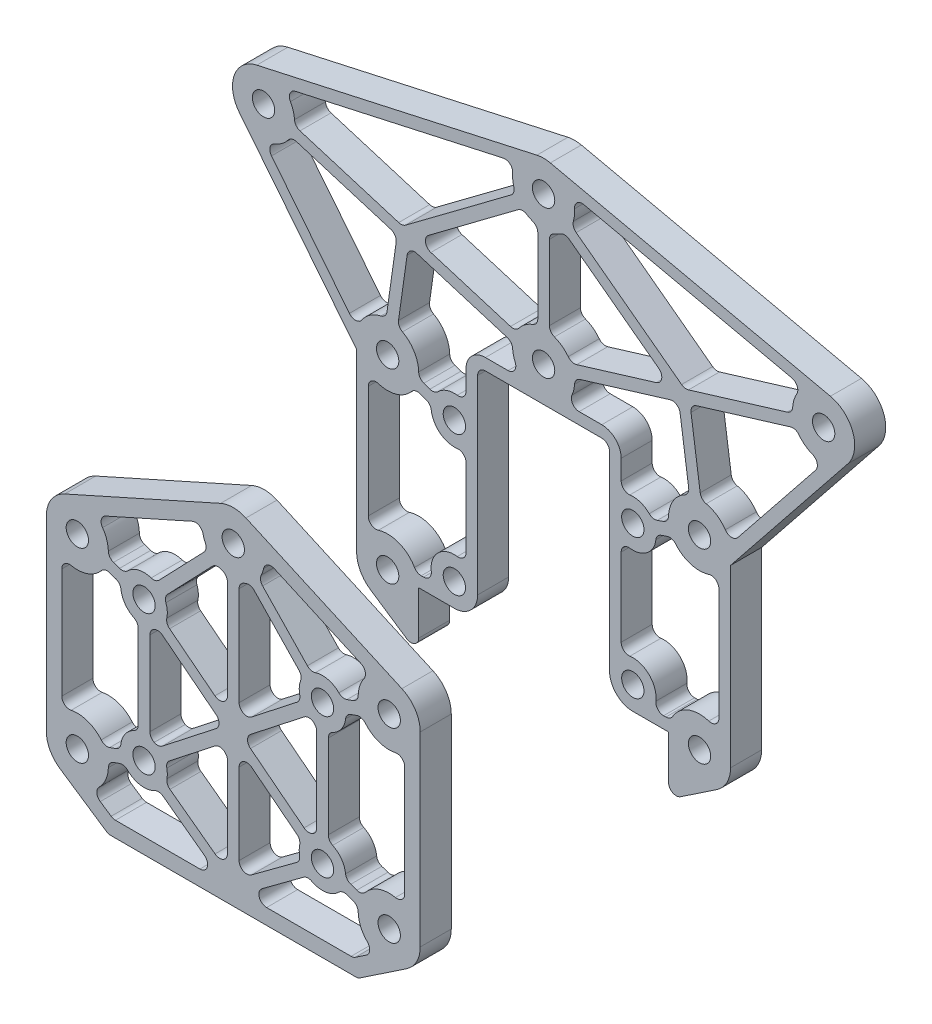
from build123d import *

# Parameters (mm, degrees)
SKETCH1_R               = 2.286
BOSS_EXTRUDE1_DEPTH     = 6.35
BOSS_EXTRUDE2_START     = -57.15
SKETCH1_3_R             = 2.286
BOSS_EXTRUDE2_DEPTH     = 6.35
FILLET1_R               = 1.5875
FILLET2_R               = 1.5875
CUT_EXTRUDE1_DEPTH      = 7.62
FILLET3_R               = 4.7625
CUT_EXTRUDE2_START      = -9.525
SKETCH4_R               = 2.286
CUT_EXTRUDE2_DEPTH      = 9.525
CUT_EXTRUDE3_DEPTH      = 118.518004797
CUT_EXTRUDE3_DEPTH_BACK = 118.518004797
SKETCH4_3_R             = 2.286
CUT_EXTRUDE4_START      = -7.62
CUT_EXTRUDE4_DEPTH      = 7.62
FILLET4_R               = 1.5875
CUT_EXTRUDE5_DEPTH      = 7.62
FILLET5_R               = 1.5875


with BuildPart() as part:
    # Sketch1 → Boss-Extrude1 (new body)
    with BuildSketch(Plane.XY):
        with BuildLine():
            Line((-25.55875, -30.95625), (25.55875, -30.95625))
            Line((25.55875, -30.95625), (35.446293253, -24.323356401))
            ThreePointArc((35.446293253, -24.323356401), (37.511691176, -22.038235294), (38.25875, -19.05))
            Line((38.25875, -19.05), (38.25875, 16.822540273))
            Line((38.25875, 16.822540273), (62.26726694, 46.833186448))
            ThreePointArc((62.26726694, 46.833186448), (63.297385155, 52.911575001), (58.682621452, 56.999594925))
            Line((58.682621452, 56.999594925), (1.373871452, 69.699594925))
            ThreePointArc((1.373871452, 69.699594925), (0, 69.85), (-1.373871452, 69.699594925))
            Line((-1.373871452, 69.699594925), (-58.682621452, 56.999594925))
            ThreePointArc((-58.682621452, 56.999594925), (-63.297385155, 52.911575001), (-62.26726694, 46.833186448))
            Line((-62.26726694, 46.833186448), (-38.25875, 16.822540273))
            Line((-38.25875, 16.822540273), (-38.25875, -19.05))
            ThreePointArc((-38.25875, -19.05), (-37.511691176, -22.038235294), (-35.446293253, -24.323356401))
            Line((-35.446293253, -24.323356401), (-25.55875, -30.95625))
        make_face()
        with Locations((-31.90875, -19.05)):
            Circle(SKETCH1_R, mode=Mode.SUBTRACT)
        with Locations((-18.25625, -14.2875)):
            Circle(SKETCH1_R, mode=Mode.SUBTRACT)
        with Locations((18.25625, -14.2875)):
            Circle(SKETCH1_R, mode=Mode.SUBTRACT)
        with Locations((31.90875, -19.05)):
            Circle(SKETCH1_R, mode=Mode.SUBTRACT)
        with Locations((-31.90875, 19.05)):
            Circle(SKETCH1_R, mode=Mode.SUBTRACT)
        with Locations((-57.30875, 50.8)):
            Circle(SKETCH1_R, mode=Mode.SUBTRACT)
        with Locations((31.90875, 19.05)):
            Circle(SKETCH1_R, mode=Mode.SUBTRACT)
        with Locations((57.30875, 50.8)):
            Circle(SKETCH1_R, mode=Mode.SUBTRACT)
        with Locations((0, 63.5)):
            Circle(SKETCH1_R, mode=Mode.SUBTRACT)
    extrude(amount=BOSS_EXTRUDE1_DEPTH)

    # Fillet2
    fillet2_edges = [part.edges().sort_by_distance(p)[0] for p in [
        (25.55875, -30.95625, 3.175),
        (-25.55875, -30.95625, 3.175),
    ]]
    fillet(fillet2_edges, radius=FILLET2_R)

    # Sketch4 → Cut-Extrude2 (cut)
    # profile 1 of 3: a face of its own
    with BuildSketch(Plane.XY.offset(6.35).offset(CUT_EXTRUDE2_START)):
        with BuildLine():
            Line((-98.245897659, 9.07752692), (-38.25875, 16.822540273))
            Line((-38.25875, 16.822540273), (-62.26726694, 46.833186448))
            ThreePointArc((-62.26726694, 46.833186448), (-63.297385155, 52.911575001), (-58.682621452, 56.999594925))
            Line((-58.682621452, 56.999594925), (-1.373871452, 69.699594925))
            ThreePointArc((-1.373871452, 69.699594925), (0, 69.85), (1.373871452, 69.699594925))
            Line((1.373871452, 69.699594925), (58.682621452, 56.999594925))
            ThreePointArc((58.682621452, 56.999594925), (63.297385155, 52.911575001), (62.26726694, 46.833186448))
            Line((62.26726694, 46.833186448), (38.25875, 16.822540273))
            Line((38.25875, 16.822540273), (125.422392006, 90.402311249))
            Line((125.422392006, 90.402311249), (-79.231707288, 82.909223574))
            Line((-79.231707288, 82.909223574), (-98.245897659, 9.07752692))
        make_face()
    # profile 2 of 3: a face of its own
    with BuildSketch(Plane.XY.offset(6.35).offset(CUT_EXTRUDE2_START)):
        with Locations((0, 33.3375)):
            Circle(SKETCH4_R)
    # profile 3 of 3: a face of its own
    with BuildSketch(Plane.XY.offset(6.35).offset(CUT_EXTRUDE2_START)):
        with BuildLine():
            ThreePointArc((-38.25875, 19.05), (-37.237956498, 22.502833345), (-34.503771069, 24.845547054))
            Line((-34.503771069, 24.845547054), (-2.595021069, 39.133047054))
            ThreePointArc((-2.595021069, 39.133047054), (0, 39.6875), (2.595021069, 39.133047054))
            Line((2.595021069, 39.133047054), (34.503771069, 24.845547054))
            ThreePointArc((34.503771069, 24.845547054), (37.237956498, 22.502833345), (38.25875, 19.05))
            Line((38.25875, 19.05), (38.25875, 16.822540273))
            Line((38.25875, 16.822540273), (62.26726694, 46.833186448))
            ThreePointArc((62.26726694, 46.833186448), (63.297385155, 52.911575001), (58.682621452, 56.999594925))
            Line((58.682621452, 56.999594925), (1.373871452, 69.699594925))
            ThreePointArc((1.373871452, 69.699594925), (0, 69.85), (-1.373871452, 69.699594925))
            Line((-1.373871452, 69.699594925), (-58.682621452, 56.999594925))
            ThreePointArc((-58.682621452, 56.999594925), (-63.297385155, 52.911575001), (-62.26726694, 46.833186448))
            Line((-62.26726694, 46.833186448), (-38.25875, 16.822540273))
            Line((-38.25875, 16.822540273), (-38.25875, 19.05))
        make_face()
        with Locations(Location((-57.30875, 50.8, 0), (0, 0, 270))):
            Circle(SKETCH4_R, mode=Mode.SUBTRACT)
        with Locations(Location((0, 63.5, 0), (0, 0, 270))):
            Circle(SKETCH4_R, mode=Mode.SUBTRACT)
        with Locations(Location((57.30875, 50.8, 0), (0, 0, 270))):
            Circle(SKETCH4_R, mode=Mode.SUBTRACT)
    extrude(amount=CUT_EXTRUDE2_DEPTH, mode=Mode.SUBTRACT)


with BuildPart() as body_2:
    # Sketch1<3> → Boss-Extrude2 (new body)
    with BuildSketch(Plane.XY.offset(BOSS_EXTRUDE2_START)):
        with BuildLine():
            Line((-25.55875, -19.05), (25.55875, -19.05))
            Line((25.55875, -19.05), (25.55875, -30.95625))
            Line((25.55875, -30.95625), (35.446293253, -24.323356401))
            ThreePointArc((35.446293253, -24.323356401), (37.511691176, -22.038235294), (38.25875, -19.05))
            Line((38.25875, -19.05), (38.25875, 16.822540273))
            Line((38.25875, 16.822540273), (62.26726694, 46.833186448))
            ThreePointArc((62.26726694, 46.833186448), (63.297385155, 52.911575001), (58.682621452, 56.999594925))
            Line((58.682621452, 56.999594925), (1.373871452, 69.699594925))
            ThreePointArc((1.373871452, 69.699594925), (0, 69.85), (-1.373871452, 69.699594925))
            Line((-1.373871452, 69.699594925), (-58.682621452, 56.999594925))
            ThreePointArc((-58.682621452, 56.999594925), (-63.297385155, 52.911575001), (-62.26726694, 46.833186448))
            Line((-62.26726694, 46.833186448), (-38.25875, 16.822540273))
            Line((-38.25875, 16.822540273), (-38.25875, -19.05))
            ThreePointArc((-38.25875, -19.05), (-37.511691176, -22.038235294), (-35.446293253, -24.323356401))
            Line((-35.446293253, -24.323356401), (-25.55875, -30.95625))
            Line((-25.55875, -30.95625), (-25.55875, -19.05))
        make_face()
        with Locations(Location((-31.90875, -19.05, 0), (0, 0, 270))):
            Circle(SKETCH1_3_R, mode=Mode.SUBTRACT)
        with Locations(Location((-18.25625, -14.2875, 0), (0, 0, 270))):
            Circle(SKETCH1_3_R, mode=Mode.SUBTRACT)
        with Locations(Location((18.25625, -14.2875, 0), (0, 0, 270))):
            Circle(SKETCH1_3_R, mode=Mode.SUBTRACT)
        with Locations(Location((31.90875, -19.05, 0), (0, 0, 270))):
            Circle(SKETCH1_3_R, mode=Mode.SUBTRACT)
        with Locations(Location((-31.90875, 19.05, 0), (0, 0, 270))):
            Circle(SKETCH1_3_R, mode=Mode.SUBTRACT)
        with Locations(Location((-57.30875, 50.8, 0), (0, 0, 270))):
            Circle(SKETCH1_3_R, mode=Mode.SUBTRACT)
        with Locations(Location((31.90875, 19.05, 0), (0, 0, 270))):
            Circle(SKETCH1_3_R, mode=Mode.SUBTRACT)
        with Locations(Location((57.30875, 50.8, 0), (0, 0, 270))):
            Circle(SKETCH1_3_R, mode=Mode.SUBTRACT)
        with Locations(Location((0, 63.5, 0), (0, 0, 270))):
            Circle(SKETCH1_3_R, mode=Mode.SUBTRACT)
    extrude(amount=-BOSS_EXTRUDE2_DEPTH)

    # Fillet1
    fillet1_edges = [body_2.edges().sort_by_distance(p)[0] for p in [
        (-25.55875, -30.95625, -60.325),
        (25.55875, -30.95625, -60.325),
    ]]
    fillet(fillet1_edges, radius=FILLET1_R)

    # Sketch3 → Cut-Extrude1 (cut)
    with BuildSketch(Plane(origin=(0, 0, -63.5), x_dir=(-1, 0, 0), z_dir=(0, 0, -1))):
        with BuildLine():
            Line((11.90625, 26.19375), (-11.90625, 26.19375))
            ThreePointArc((-11.90625, 26.19375), (-13.028782015, 25.728782015), (-13.49375, 24.60625))
            Line((-13.49375, 24.60625), (-13.49375, -24.60625))
            ThreePointArc((-13.49375, -24.60625), (-13.028782015, -25.728782015), (-11.90625, -26.19375))
            Line((-11.90625, -26.19375), (11.90625, -26.19375))
            ThreePointArc((11.90625, -26.19375), (13.028782015, -25.728782015), (13.49375, -24.60625))
            Line((13.49375, -24.60625), (13.49375, 24.60625))
            ThreePointArc((13.49375, 24.60625), (13.028782015, 25.728782015), (11.90625, 26.19375))
        make_face()
    extrude(amount=-CUT_EXTRUDE1_DEPTH, mode=Mode.SUBTRACT)

    # Fillet3
    fillet3_edges = [body_2.edges().sort_by_distance(p)[0] for p in [
        (-13.49375, -19.05, -60.325),
        (13.49375, -19.05, -60.325),
    ]]
    fillet(fillet3_edges, radius=FILLET3_R)


with BuildPart() as cut_extrude3_tool:
    # Sketch4<3> → Cut-Extrude3 (new, two sides: drawn at the far end of the back side and taken through both)
    with BuildSketch(Plane.XY.offset(6.35).offset(-CUT_EXTRUDE3_DEPTH_BACK)):
        with Locations((0, 33.3375)):
            Circle(SKETCH4_3_R)
        with Locations((-18.25625, 14.2875)):
            Circle(SKETCH4_3_R)
        with Locations((18.25625, 14.2875)):
            Circle(SKETCH4_3_R)
    extrude(amount=CUT_EXTRUDE3_DEPTH + CUT_EXTRUDE3_DEPTH_BACK)


with BuildPart() as part_1:
    add(part.part)

    # Cut-Extrude3: cut by cut_extrude3_tool
    add(cut_extrude3_tool.part, mode=Mode.SUBTRACT)

    # Sketch5 → Cut-Extrude4 (cut)
    with BuildSketch(Plane.XY.offset(6.35).offset(CUT_EXTRUDE4_START)):
        with BuildLine():
            ThreePointArc((-5.175294039, 29.657984868), (-6.140276786, 31.719012747), (-6.316601512, 33.987919358))
            Line((-6.316601512, 33.987919358), (-28.187169557, 24.195127696))
            ThreePointArc((-28.187169557, 24.195127696), (-26.25390536, 21.938811537), (-25.55875, 19.05))
            ThreePointArc((-25.55875, 19.05), (-25.575899591, 18.583624933), (-25.627255733, 18.119768966))
            Line((-25.627255733, 18.119768966), (-22.218053999, 16.930512547))
            ThreePointArc((-22.218053999, 16.930512547), (-19.36755679, 18.918526179), (-15.925304211, 18.440582949))
            Line((-15.925304211, 18.440582949), (-5.175294039, 29.657984868))
        make_face()
        with BuildLine():
            ThreePointArc((-26.411573181, 15.871392283), (-30.267261476, 12.915832133), (-35.08375, 13.550738686))
            Line((-35.08375, 13.550738686), (-35.08375, -13.550738686))
            ThreePointArc((-35.08375, -13.550738686), (-30.267261476, -12.915832133), (-26.411573181, -15.871392283))
            Line((-26.411573181, -15.871392283), (-23.002371446, -14.682135865))
            ThreePointArc((-23.002371446, -14.682135865), (-22.139034435, -11.529712611), (-19.446875, -9.676229203))
            Line((-19.446875, -9.676229203), (-19.446875, 9.676229203))
            ThreePointArc((-19.446875, 9.676229203), (-22.139034435, 11.529712611), (-23.002371446, 14.682135865))
            Line((-23.002371446, 14.682135865), (-26.411573181, 15.871392283))
        make_face()
        with BuildLine():
            Line((-1.931866039, 0), (-15.358643211, 10.50791257))
            ThreePointArc((-15.358643211, 10.50791257), (-16.170264838, 10.006136648), (-17.065625, 9.676229203))
            Line((-17.065625, 9.676229203), (-17.065625, -9.676229203))
            ThreePointArc((-17.065625, -9.676229203), (-16.170264838, -10.006136648), (-15.358643211, -10.50791257))
            Line((-15.358643211, -10.50791257), (-1.931866039, 0))
        make_face()
        with BuildLine():
            ThreePointArc((-25.55875, -19.05), (-26.519391735, -22.408171748), (-29.110661019, -24.750280524))
            Line((-29.110661019, -24.750280524), (-24.592445652, -27.78125))
            Line((-24.592445652, -27.78125), (-2.003100447, -27.78125))
            Line((-2.003100447, -27.78125), (-15.255672901, -17.98587036))
            ThreePointArc((-15.255672901, -17.98587036), (-18.969996676, -18.996212343), (-22.218053999, -16.930512547))
            Line((-22.218053999, -16.930512547), (-25.627255733, -18.119768966))
            ThreePointArc((-25.627255733, -18.119768966), (-25.575899591, -18.583624933), (-25.55875, -19.05))
        make_face()
        with BuildLine():
            Line((-1.190625, -25.420670322), (-1.190625, -2.443688639))
            Line((-1.190625, -2.443688639), (-13.891059163, -12.383158853))
            ThreePointArc((-13.891059163, -12.383158853), (-13.594135265, -13.314827165), (-13.49375, -14.2875))
            ThreePointArc((-13.49375, -14.2875), (-13.581184907, -15.195890128), (-13.840279186, -16.070925923))
            Line((-13.840279186, -16.070925923), (-1.190625, -25.420670322))
        make_face()
        with BuildLine():
            Line((13.891059163, -12.383158853), (1.190625, -2.443688639))
            Line((1.190625, -2.443688639), (1.190625, -25.420670322))
            Line((1.190625, -25.420670322), (13.840279186, -16.070925923))
            ThreePointArc((13.840279186, -16.070925923), (13.494201441, -14.221927336), (13.891059163, -12.383158853))
        make_face()
        with BuildLine():
            Line((24.592445652, -27.78125), (29.110661019, -24.750280524))
            ThreePointArc((29.110661019, -24.750280524), (26.287306336, -22.003281418), (25.627255733, -18.119768966))
            Line((25.627255733, -18.119768966), (22.218053999, -16.930512547))
            ThreePointArc((22.218053999, -16.930512547), (18.969996676, -18.996212343), (15.255672901, -17.98587036))
            Line((15.255672901, -17.98587036), (2.003100447, -27.78125))
            Line((2.003100447, -27.78125), (24.592445652, -27.78125))
        make_face()
        with BuildLine():
            Line((35.08375, -13.550738686), (35.08375, 13.550738686))
            ThreePointArc((35.08375, 13.550738686), (30.267261476, 12.915832133), (26.411573181, 15.871392283))
            Line((26.411573181, 15.871392283), (23.002371446, 14.682135865))
            ThreePointArc((23.002371446, 14.682135865), (23.0146536, 14.484987799), (23.01875, 14.2875))
            ThreePointArc((23.01875, 14.2875), (22.021336839, 11.371076275), (19.446875, 9.676229203))
            Line((19.446875, 9.676229203), (19.446875, -9.676229203))
            ThreePointArc((19.446875, -9.676229203), (22.021336839, -11.371076275), (23.01875, -14.2875))
            ThreePointArc((23.01875, -14.2875), (23.0146536, -14.484987799), (23.002371446, -14.682135865))
            Line((23.002371446, -14.682135865), (26.411573181, -15.871392283))
            ThreePointArc((26.411573181, -15.871392283), (30.267261476, -12.915832133), (35.08375, -13.550738686))
        make_face()
        with BuildLine():
            Line((15.358643211, 10.50791257), (1.931866039, 0))
            Line((1.931866039, 0), (15.358643211, -10.50791257))
            ThreePointArc((15.358643211, -10.50791257), (16.170264838, -10.006136648), (17.065625, -9.676229203))
            Line((17.065625, -9.676229203), (17.065625, 9.676229203))
            ThreePointArc((17.065625, 9.676229203), (16.170264838, 10.006136648), (15.358643211, 10.50791257))
        make_face()
        with BuildLine():
            Line((14.206069798, 16.792983303), (3.456059626, 28.010385221))
            ThreePointArc((3.456059626, 28.010385221), (2.367501911, 27.445349739), (1.190625, 27.100119772))
            Line((1.190625, 27.100119772), (1.190625, 2.443688639))
            Line((1.190625, 2.443688639), (13.891059163, 12.383158853))
            ThreePointArc((13.891059163, 12.383158853), (13.505854716, 14.626838913), (14.206069798, 16.792983303))
        make_face()
        with BuildLine():
            ThreePointArc((-1.190625, 27.100119772), (-2.367501911, 27.445349739), (-3.456059626, 28.010385221))
            Line((-3.456059626, 28.010385221), (-14.206069798, 16.792983303))
            ThreePointArc((-14.206069798, 16.792983303), (-13.675289977, 15.589886854), (-13.49375, 14.2875))
            ThreePointArc((-13.49375, 14.2875), (-13.594135265, 13.314827165), (-13.891059163, 12.383158853))
            Line((-13.891059163, 12.383158853), (-1.190625, 2.443688639))
            Line((-1.190625, 2.443688639), (-1.190625, 27.100119772))
        make_face()
        with BuildLine():
            Line((28.187169557, 24.195127696), (6.316601512, 33.987919358))
            ThreePointArc((6.316601512, 33.987919358), (6.341644881, 33.663138143), (6.35, 33.3375))
            ThreePointArc((6.35, 33.3375), (6.049199003, 31.406259097), (5.175294039, 29.657984868))
            Line((5.175294039, 29.657984868), (15.925304211, 18.440582949))
            ThreePointArc((15.925304211, 18.440582949), (19.36755679, 18.918526179), (22.218053999, 16.930512547))
            Line((22.218053999, 16.930512547), (25.627255733, 18.119768966))
            ThreePointArc((25.627255733, 18.119768966), (26.057009076, 21.5156902), (28.187169557, 24.195127696))
        make_face()
    extrude(amount=CUT_EXTRUDE4_DEPTH, mode=Mode.SUBTRACT)

    # Fillet4
    fillet4_edges = [part_1.edges().sort_by_distance(p)[0] for p in [
        (-22.218053999, -16.930512547, 3.175),
        (-15.255672901, -17.98587036, 3.175),
        (-2.003100447, -27.78125, 3.175),
        (-24.592445652, -27.78125, 3.175),
        (-29.110661019, -24.750280524, 3.175),
        (-25.627255733, -18.119768966, 3.175),
        (-13.840279186, -16.070925923, 3.175),
        (-13.891059163, -12.383158853, 3.175),
        (-1.190625, -2.443688639, 3.175),
        (-1.190625, -25.420670322, 3.175),
        (-15.358643211, -10.50791257, 3.175),
        (-17.065625, -9.676229203, 3.175),
        (-17.065625, 9.676229203, 3.175),
        (-15.358643211, 10.50791257, 3.175),
        (-1.931866039, 0, 3.175),
        (-19.446875, -9.676229203, 3.175),
        (-23.002371446, -14.682135865, 3.175),
        (-26.411573181, -15.871392283, 3.175),
        (-35.08375, -13.550738686, 3.175),
        (-35.08375, 13.550738686, 3.175),
        (-26.411573181, 15.871392283, 3.175),
        (-23.002371446, 14.682135865, 3.175),
        (-19.446875, 9.676229203, 3.175),
        (15.358643211, 10.50791257, 3.175),
        (17.065625, 9.676229203, 3.175),
        (17.065625, -9.676229203, 3.175),
        (15.358643211, -10.50791257, 3.175),
        (1.931866039, 0, 3.175),
        (19.446875, 9.676229203, 3.175),
        (23.002371446, 14.682135865, 3.175),
        (26.411573181, 15.871392283, 3.175),
        (35.08375, 13.550738686, 3.175),
        (35.08375, -13.550738686, 3.175),
        (26.411573181, -15.871392283, 3.175),
        (23.002371446, -14.682135865, 3.175),
        (19.446875, -9.676229203, 3.175),
        (13.891059163, -12.383158853, 3.175),
        (13.840279186, -16.070925923, 3.175),
        (1.190625, -25.420670322, 3.175),
        (1.190625, -2.443688639, 3.175),
        (15.255672901, -17.98587036, 3.175),
        (22.218053999, -16.930512547, 3.175),
        (25.627255733, -18.119768966, 3.175),
        (29.110661019, -24.750280524, 3.175),
        (24.592445652, -27.78125, 3.175),
        (2.003100447, -27.78125, 3.175),
        (22.218053999, 16.930512547, 3.175),
        (15.925304211, 18.440582949, 3.175),
        (5.175294039, 29.657984868, 3.175),
        (6.316601512, 33.987919358, 3.175),
        (28.187169557, 24.195127696, 3.175),
        (25.627255733, 18.119768966, 3.175),
        (-13.891059163, 12.383158853, 3.175),
        (-14.206069798, 16.792983303, 3.175),
        (-3.456059626, 28.010385221, 3.175),
        (-1.190625, 27.100119772, 3.175),
        (-1.190625, 2.443688639, 3.175),
        (14.206069798, 16.792983303, 3.175),
        (13.891059163, 12.383158853, 3.175),
        (1.190625, 2.443688639, 3.175),
        (1.190625, 27.100119772, 3.175),
        (3.456059626, 28.010385221, 3.175),
        (-15.925304211, 18.440582949, 3.175),
        (-22.218053999, 16.930512547, 3.175),
        (-25.627255733, 18.119768966, 3.175),
        (-28.187169557, 24.195127696, 3.175),
        (-6.316601512, 33.987919358, 3.175),
        (-5.175294039, 29.657984868, 3.175),
    ]]
    fillet(fillet4_edges, radius=FILLET4_R)


with BuildPart() as body_2_1:
    add(body_2.part)

    # Cut-Extrude3: cut by cut_extrude3_tool
    add(cut_extrude3_tool.part, mode=Mode.SUBTRACT)

    # Sketch6 → Cut-Extrude5 (cut)
    with BuildSketch(Plane(origin=(0, 0, -63.5), x_dir=(-1, 0, 0), z_dir=(0, 0, -1))):
        with BuildLine():
            ThreePointArc((-51.689252976, 47.8430162), (-54.027613266, 45.363397961), (-57.311230251, 44.450000484))
            Line((-57.311230251, 44.450000484), (-38.104415924, 20.441482576))
            ThreePointArc((-38.104415924, 20.441482576), (-35.994771664, 23.910753744), (-32.214497942, 25.392634957))
            Line((-32.214497942, 25.392634957), (-29.975881206, 41.226753333))
            Line((-29.975881206, 41.226753333), (-51.689252976, 47.8430162))
        make_face()
        with BuildLine():
            Line((-5.698226894, 66.30226877), (-53.32786242, 55.747224886))
            ThreePointArc((-53.32786242, 55.747224886), (-51.442917847, 53.23197721), (-50.995171166, 50.120866503))
            Line((-50.995171166, 50.120866503), (-28.884395385, 43.383511002))
            Line((-28.884395385, 43.383511002), (-5.707987429, 60.717666536))
            ThreePointArc((-5.707987429, 60.717666536), (-6.349990301, 63.511098248), (-5.698226894, 66.30226877))
        make_face()
        with BuildLine():
            ThreePointArc((-26.411573181, 15.871392283), (-30.736289888, 12.809179759), (-35.8775, 14.093032839))
            Line((-35.8775, 14.093032839), (-35.8775, -14.093032839))
            ThreePointArc((-35.8775, -14.093032839), (-30.303096202, -12.906354838), (-26.022142451, -16.66875))
            Line((-26.022142451, -16.66875), (-22.380695986, -16.66875))
            ThreePointArc((-22.380695986, -16.66875), (-21.623846045, -10.919903955), (-15.875, -10.163054014))
            Line((-15.875, -10.163054014), (-15.875, 10.163054014))
            ThreePointArc((-15.875, 10.163054014), (-20.806481251, 10.2653455), (-23.002371446, 14.682135865))
            Line((-23.002371446, 14.682135865), (-26.411573181, 15.871392283))
        make_face()
        with BuildLine():
            Line((-27.670275125, 40.524214084), (-29.856695362, 25.059290454))
            ThreePointArc((-29.856695362, 25.059290454), (-26.486458145, 22.354731614), (-25.627255733, 18.119768966))
            Line((-25.627255733, 18.119768966), (-22.218053999, 16.930512547))
            ThreePointArc((-22.218053999, 16.930512547), (-19.339393109, 18.925194174), (-15.875, 18.411945986))
            Line((-15.875, 18.411945986), (-15.875, 24.60625))
            ThreePointArc((-15.875, 24.60625), (-14.712580038, 27.412580038), (-11.90625, 28.575))
            Line((-11.90625, 28.575), (-4.200130206, 28.575))
            ThreePointArc((-4.200130206, 28.575), (-5.91923671, 31.038557466), (-6.313578834, 34.016633497))
            Line((-6.313578834, 34.016633497), (-27.670275125, 40.524214084))
        make_face()
        with BuildLine():
            Line((53.32786242, 55.747224886), (5.698226894, 66.30226877))
            ThreePointArc((5.698226894, 66.30226877), (6.349990301, 63.511098248), (5.707987429, 60.717666536))
            Line((5.707987429, 60.717666536), (28.884395385, 43.383511002))
            Line((28.884395385, 43.383511002), (50.995171166, 50.120866503))
            ThreePointArc((50.995171166, 50.120866503), (51.442917847, 53.23197721), (53.32786242, 55.747224886))
        make_face()
        with BuildLine():
            ThreePointArc((-1.190625, 57.262619772), (-2.843585389, 57.822278438), (-4.281774185, 58.810766606))
            Line((-4.281774185, 58.810766606), (-26.059478409, 42.522732976))
            Line((-26.059478409, 42.522732976), (-5.619497024, 36.2944838))
            ThreePointArc((-5.619497024, 36.2944838), (-3.779509317, 38.440225676), (-1.190625, 39.574880228))
            Line((-1.190625, 39.574880228), (-1.190625, 57.262619772))
        make_face()
        with BuildLine():
            ThreePointArc((6.313578834, 34.016633497), (5.91923671, 31.038557466), (4.200130206, 28.575))
            Line((4.200130206, 28.575), (11.90625, 28.575))
            ThreePointArc((11.90625, 28.575), (14.712580038, 27.412580038), (15.875, 24.60625))
            Line((15.875, 24.60625), (15.875, 18.411945986))
            ThreePointArc((15.875, 18.411945986), (19.339393109, 18.925194174), (22.218053999, 16.930512547))
            Line((22.218053999, 16.930512547), (25.627255733, 18.119768966))
            ThreePointArc((25.627255733, 18.119768966), (26.486458145, 22.354731614), (29.856695362, 25.059290454))
            Line((29.856695362, 25.059290454), (27.670275125, 40.524214084))
            Line((27.670275125, 40.524214084), (6.313578834, 34.016633497))
        make_face()
        with BuildLine():
            Line((38.104415924, 20.441482576), (57.311230251, 44.450000484))
            ThreePointArc((57.311230251, 44.450000484), (54.027613266, 45.363397961), (51.689252976, 47.8430162))
            Line((51.689252976, 47.8430162), (29.975881206, 41.226753333))
            Line((29.975881206, 41.226753333), (32.214497942, 25.392634957))
            ThreePointArc((32.214497942, 25.392634957), (35.994771664, 23.910753744), (38.104415924, 20.441482576))
        make_face()
        with BuildLine():
            ThreePointArc((4.281774185, 58.810766606), (2.843585389, 57.822278438), (1.190625, 57.262619772))
            Line((1.190625, 57.262619772), (1.190625, 39.574880228))
            ThreePointArc((1.190625, 39.574880228), (3.779509317, 38.440225676), (5.619497024, 36.2944838))
            Line((5.619497024, 36.2944838), (26.059478409, 42.522732976))
            Line((26.059478409, 42.522732976), (4.281774185, 58.810766606))
        make_face()
        with BuildLine():
            ThreePointArc((26.022142451, -16.66875), (30.303096202, -12.906354838), (35.8775, -14.093032839))
            Line((35.8775, -14.093032839), (35.8775, 14.093032839))
            ThreePointArc((35.8775, 14.093032839), (30.736289888, 12.809179759), (26.411573181, 15.871392283))
            Line((26.411573181, 15.871392283), (23.002371446, 14.682135865))
            ThreePointArc((23.002371446, 14.682135865), (20.806481251, 10.2653455), (15.875, 10.163054014))
            Line((15.875, 10.163054014), (15.875, -10.163054014))
            ThreePointArc((15.875, -10.163054014), (21.623846045, -10.919903955), (22.380695986, -16.66875))
            Line((22.380695986, -16.66875), (26.022142451, -16.66875))
        make_face()
    extrude(amount=-CUT_EXTRUDE5_DEPTH, mode=Mode.SUBTRACT)

    # Fillet5
    fillet5_edges = [body_2_1.edges().sort_by_distance(p)[0] for p in [
        (-15.875, 10.163054014, -60.325),
        (-23.002371446, 14.682135865, -60.325),
        (-26.411573181, 15.871392283, -60.325),
        (-35.8775, 14.093032839, -60.325),
        (-35.8775, -14.093032839, -60.325),
        (-26.022142451, -16.66875, -60.325),
        (-22.380695986, -16.66875, -60.325),
        (-15.875, -10.163054014, -60.325),
        (-53.32786242, 55.747224886, -60.325),
        (-50.995171166, 50.120866503, -60.325),
        (-28.884395385, 43.383511002, -60.325),
        (-5.707987429, 60.717666536, -60.325),
        (-5.698226894, 66.30226877, -60.325),
        (-5.619497024, 36.2944838, -60.325),
        (-1.190625, 39.574880228, -60.325),
        (-1.190625, 57.262619772, -60.325),
        (-4.281774185, 58.810766606, -60.325),
        (-26.059478409, 42.522732976, -60.325),
        (-4.200130206, 28.575, -60.325),
        (-6.313578834, 34.016633497, -60.325),
        (-27.670275125, 40.524214084, -60.325),
        (-29.856695362, 25.059290454, -60.325),
        (-25.627255733, 18.119768966, -60.325),
        (-22.218053999, 16.930512547, -60.325),
        (-15.875, 18.411945986, -60.325),
        (-38.104415924, 20.441482576, -60.325),
        (-32.214497942, 25.392634957, -60.325),
        (-29.975881206, 41.226753333, -60.325),
        (-51.689252976, 47.8430162, -60.325),
        (-57.311230251, 44.450000484, -60.325),
        (15.875, 18.411945986, -60.325),
        (22.218053999, 16.930512547, -60.325),
        (25.627255733, 18.119768966, -60.325),
        (29.856695362, 25.059290454, -60.325),
        (27.670275125, 40.524214084, -60.325),
        (6.313578834, 34.016633497, -60.325),
        (4.200130206, 28.575, -60.325),
        (32.214497942, 25.392634957, -60.325),
        (38.104415924, 20.441482576, -60.325),
        (57.311230251, 44.450000484, -60.325),
        (51.689252976, 47.8430162, -60.325),
        (29.975881206, 41.226753333, -60.325),
        (1.190625, 39.574880228, -60.325),
        (5.619497024, 36.2944838, -60.325),
        (26.059478409, 42.522732976, -60.325),
        (4.281774185, 58.810766606, -60.325),
        (1.190625, 57.262619772, -60.325),
        (5.698226894, 66.30226877, -60.325),
        (5.707987429, 60.717666536, -60.325),
        (28.884395385, 43.383511002, -60.325),
        (50.995171166, 50.120866503, -60.325),
        (53.32786242, 55.747224886, -60.325),
        (35.8775, 14.093032839, -60.325),
        (26.411573181, 15.871392283, -60.325),
        (23.002371446, 14.682135865, -60.325),
        (15.875, 10.163054014, -60.325),
        (15.875, -10.163054014, -60.325),
        (22.380695986, -16.66875, -60.325),
        (26.022142451, -16.66875, -60.325),
        (35.8775, -14.093032839, -60.325),
    ]]
    fillet(fillet5_edges, radius=FILLET5_R)


solid = Compound([part_1.part, body_2_1.part])
